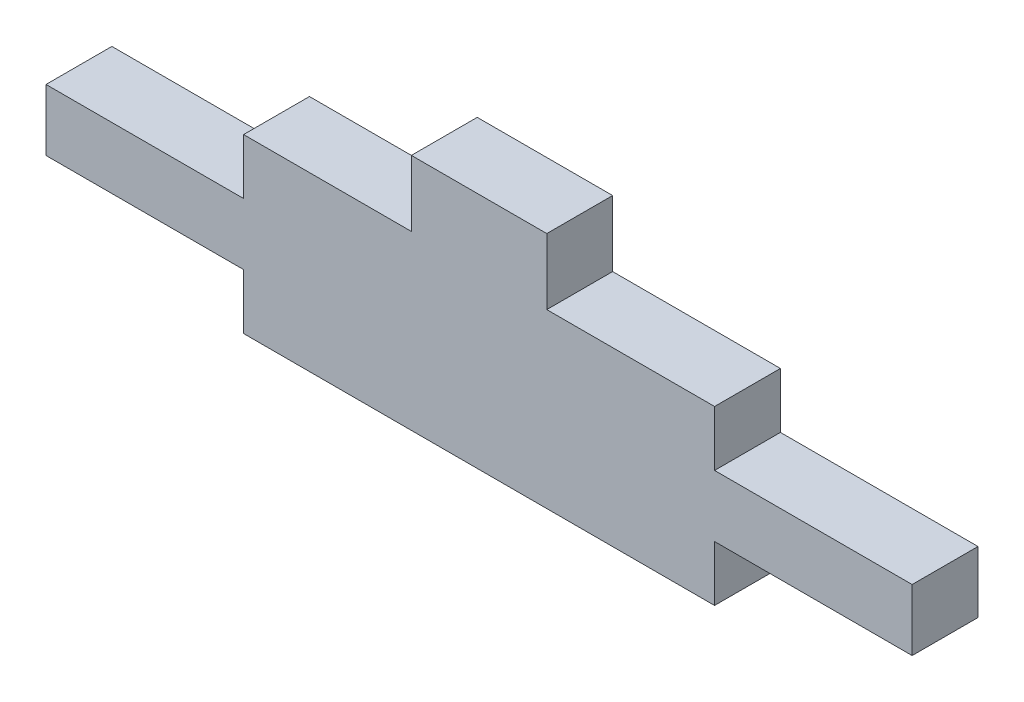
from build123d import *

# Parameters (mm, degrees)
BOSS_EXTRUDE1_DEPTH = 5.35


with BuildPart() as part:
    # Model → Boss-Extrude1 (new body)
    with BuildSketch(Plane.XY):
        Polygon((-19.13, 0), (19.13, 0), (19.13, 4.5), (35.18, 4.5), (35.18, 9.5), (19.13, 9.5), (19.13, 14), (5.5, 14), (5.5, 19.35), (-5.5, 19.35), (-5.5, 14), (-19.13, 14), (-19.13, 9.5), (-35.18, 9.5), (-35.18, 4.5), (-19.13, 4.5), align=None)
    extrude(amount=BOSS_EXTRUDE1_DEPTH)


solid = part.part
